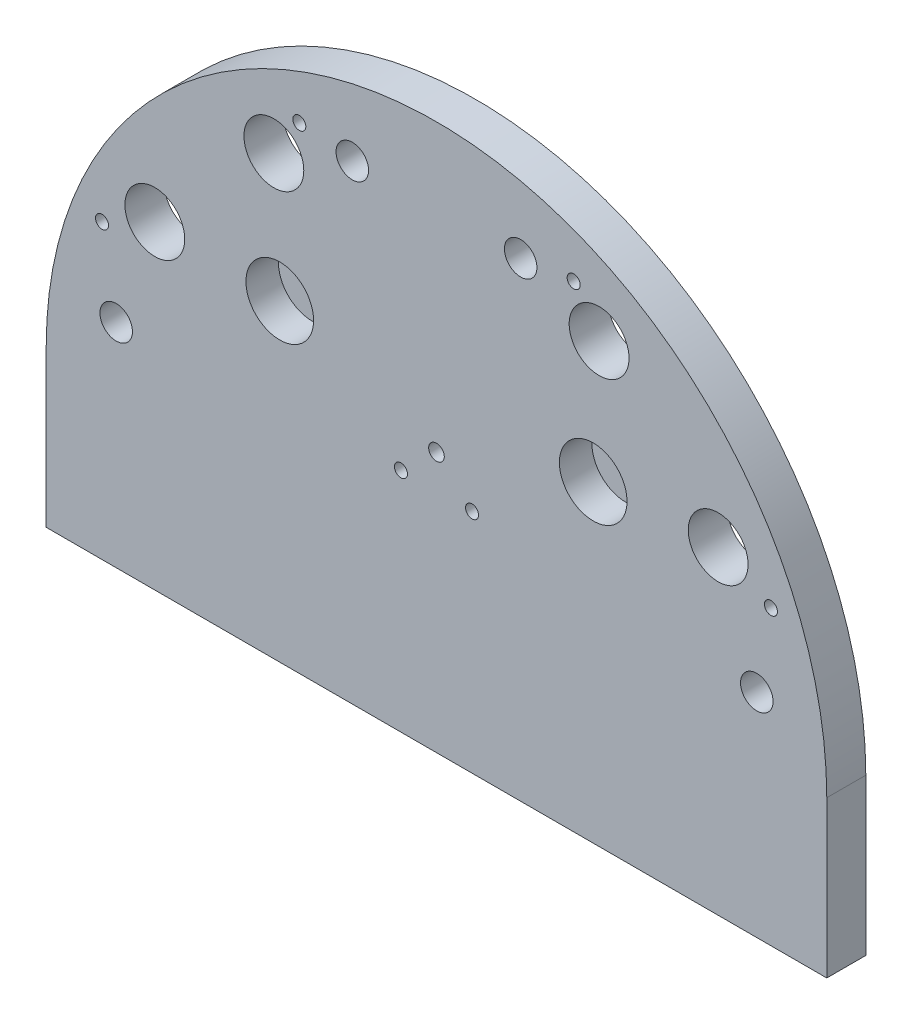
from build123d import *

# Parameters (mm, degrees)
SKETCH_1_R           = 23
EXTRUDE_1_DEPTH      = 30
CUT_EXTRUDE_1_DEPTH  = 50
SKETCH_10_R          = 12.5
CUT_EXTRUDE_6_DEPTH  = 426.323406363
SKETCH_15_R          = 5
CUT_EXTRUDE_8_DEPTH  = 426.323406363
SKETCH_16_W          = 600
SKETCH_16_H          = 120
EXTRUDE_2_DEPTH      = 30
CUT_EXTRUDE_9_REACH  = 427.323
SKETCH_17_R          = 26
EXTRUDE_START        = -5
SKETCH_18_R          = 26
EXTRUDE_3_DEPTH      = 5
SKETCH_19_R          = 6
CUT_EXTRUDE_10_DEPTH = 58


with BuildPart() as part:
    # 草图1 → 凸台-拉伸1 (new body)
    with BuildSketch(Plane.XY):
        with BuildLine():
            Line((0, 0), (-295.442325904, -52.0944533))
            ThreePointArc((-295.442325904, -52.0944533), (0, 300), (295.442325904, -52.0944533))
            Line((295.442325904, -52.0944533), (0, 0))
        make_face()
        with Locations((-125, 216.506350946)):
            Circle(SKETCH_1_R, mode=Mode.SUBTRACT)
        with Locations((-216.506350946, 125)):
            Circle(SKETCH_1_R, mode=Mode.SUBTRACT)
        with Locations((216.506350946, 125)):
            Circle(SKETCH_1_R, mode=Mode.SUBTRACT)
        with Locations((125, 216.506350946)):
            Circle(SKETCH_1_R, mode=Mode.SUBTRACT)
    extrude(amount=EXTRUDE_1_DEPTH)

    # 草图2 → 切除-拉伸1 (cut)
    with BuildSketch(Plane.XY.offset(30)):
        with BuildLine():
            Line((0, 0), (-250, 0))
            ThreePointArc((-250, 0), (0, -250), (250, 0))
            Line((250, 0), (0, 0))
        make_face()
    extrude(amount=-CUT_EXTRUDE_1_DEPTH, mode=Mode.SUBTRACT)

    # 草图10 → 切除-拉伸6 (cut, through all)
    with BuildSketch(Plane.XY.offset(30)):
        with Locations((-246.201938253, 43.412044417)):
            Circle(SKETCH_10_R)
        with Locations(Location((246.201938253, 43.412044417, 0), (0, 0, 180))):
            Circle(SKETCH_10_R)
        with Locations((-64.704761276, 241.481456572)):
            Circle(SKETCH_10_R)
        with Locations(Location((64.704761276, 241.481456572, 0), (0, 0, 180))):
            Circle(SKETCH_10_R)
    extrude(amount=-CUT_EXTRUDE_6_DEPTH, mode=Mode.SUBTRACT)

    # 草图15 → 切除-拉伸8 (cut, through all)
    with BuildSketch(Plane.XY.offset(30)):
        with Locations((-257.081286775, 104.872747053)):
            Circle(SKETCH_15_R)
        with Locations((-105.443118667, 246.486099918)):
            Circle(SKETCH_15_R)
        with Locations((-27.326692423, 54.2718973)):
            Circle(SKETCH_15_R)
        with Locations(Location((27.326692423, 54.2718973, 0), (0, 0, 180))):
            Circle(SKETCH_15_R)
        with Locations(Location((105.443118667, 246.486099918, 0), (0, 0, 180))):
            Circle(SKETCH_15_R)
        with Locations(Location((257.081286775, 104.872747053, 0), (0, 0, 180))):
            Circle(SKETCH_15_R)
    extrude(amount=-CUT_EXTRUDE_8_DEPTH, mode=Mode.SUBTRACT)

    # 草图16 → 凸台-拉伸2 (add)
    with BuildSketch(Plane.XY.offset(30)):
        with Locations((0, -60)):
            Rectangle(SKETCH_16_W, SKETCH_16_H)
    extrude(amount=-EXTRUDE_2_DEPTH)

    # 草图17 → 切除-拉伸9 (cut, up to next)
    with BuildSketch(Plane.XY.offset(30), mode=Mode.PRIVATE) as cut_extrude_9_sk1:
        with Locations((-120.47, 120.47)):
            Circle(SKETCH_17_R)
    cut_extrude_9_tool1 = extrude(cut_extrude_9_sk1.sketch, amount=-CUT_EXTRUDE_9_REACH, mode=Mode.PRIVATE) & part.part
    # 草图17 → 切除-拉伸9 (cut, up to next)
    with BuildSketch(Plane.XY.offset(30), mode=Mode.PRIVATE) as cut_extrude_9_sk2:
        with Locations((120.47, 120.47)):
            Circle(SKETCH_17_R)
    cut_extrude_9_tool2 = extrude(cut_extrude_9_sk2.sketch, amount=-CUT_EXTRUDE_9_REACH, mode=Mode.PRIVATE) & part.part
    add(cut_extrude_9_tool1.solids().sort_by_distance((-120.47, 120.47, 30))[0], mode=Mode.SUBTRACT)
    add(cut_extrude_9_tool2.solids().sort_by_distance((120.47, 120.47, 30))[0], mode=Mode.SUBTRACT)

    # 草图18 → 凸台-拉伸3 (add)
    with BuildSketch(Plane(origin=(0, 0, 0), x_dir=(-1, 0, 0), z_dir=(0, 0, -1)).offset(EXTRUDE_START)):
        with Locations(Location((120.47, 120.47, 0), (0, 0, 180))):
            Circle(SKETCH_18_R)
        with Locations((-120.47, 120.47)):
            Circle(SKETCH_18_R)
    extrude(amount=EXTRUDE_3_DEPTH)

    # 草图19 → 切除-拉伸10 (cut)
    with BuildSketch(Plane(origin=(0, 0, 0), x_dir=(-1, 0, 0), z_dir=(0, 0, -1))):
        with Locations((0, 80)):
            Circle(SKETCH_19_R)
    extrude(amount=-CUT_EXTRUDE_10_DEPTH, mode=Mode.SUBTRACT)


solid = part.part
